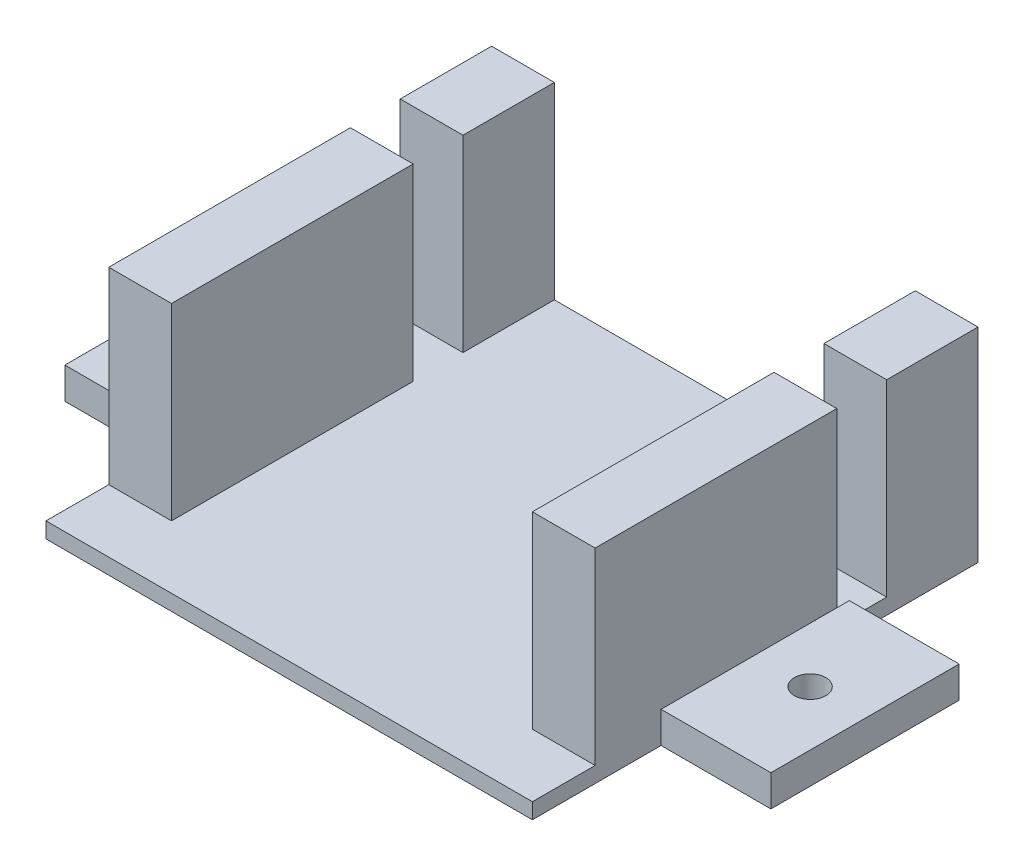
from build123d import *

# Parameters (mm, degrees)
SKETCH1_W           = 31
SKETCH1_H           = 28.4
BOSS_EXTRUDE1_DEPTH = 1
SKETCH3_W           = 4
SKETCH3_H           = 19.4
SKETCH3_H_2         = 5.825
SKETCH3_H_3         = 5.82
BOSS_EXTRUDE2_DEPTH = 12
SKETCH4_W           = 31
SKETCH4_H           = 4
CUT_EXTRUDE1_DEPTH  = 12
SKETCH7_W           = 7
SKETCH7_H           = 12
BOSS_EXTRUDE3_DEPTH = 2
SKETCH8_R           = 1
CUT_EXTRUDE4_DEPTH  = 29.790449805


with BuildPart() as part:
    # Sketch1 → Boss-Extrude1 (new body)
    with BuildSketch(Plane(origin=(0, 0, 0), x_dir=(1, 0, 0), z_dir=(0, 1, 0))):
        Rectangle(SKETCH1_W, SKETCH1_H)
    extrude(amount=BOSS_EXTRUDE1_DEPTH)

    # Sketch3 → Boss-Extrude2 (add)
    with BuildSketch(Plane(origin=(0, 1, 0), x_dir=(1, 0, 0), z_dir=(0, 1, 0))):
        with Locations((-13.5, -4.5)):
            Rectangle(SKETCH3_W, SKETCH3_H)
        with Locations((13.5, -4.5)):
            Rectangle(SKETCH3_W, SKETCH3_H)
        with Locations((-13.5, 11.2875)):
            Rectangle(SKETCH3_W, SKETCH3_H_2)
        with Locations((13.5, 11.29)):
            Rectangle(SKETCH3_W, SKETCH3_H_3)
    extrude(amount=BOSS_EXTRUDE2_DEPTH)

    # Sketch4 → Cut-Extrude1 (cut)
    with BuildSketch(Plane(origin=(0, 13, 0), x_dir=(1, 0, 0), z_dir=(0, 1, 0))):
        with Locations((0, -12.2)):
            Rectangle(SKETCH4_W, SKETCH4_H)
    extrude(amount=-CUT_EXTRUDE1_DEPTH, mode=Mode.SUBTRACT)

    # Sketch7 → Boss-Extrude3 (add)
    with BuildSketch(Plane(origin=(0, 0, 0), x_dir=(1, 0, 0), z_dir=(0, 1, 0))):
        with Locations((19, 0)):
            Rectangle(SKETCH7_W, SKETCH7_H)
        with Locations((-19, 0)):
            Rectangle(SKETCH7_W, SKETCH7_H)
    extrude(amount=BOSS_EXTRUDE3_DEPTH)

    # Sketch8 → Cut-Extrude4 (cut, through all)
    with BuildSketch(Plane(origin=(0, 2, 0), x_dir=(1, 0, 0), z_dir=(0, 1, 0))):
        with Locations(Location((-19, 0, 0), (0, 0, 270))):
            Circle(SKETCH8_R)
        with Locations(Location((19, 0, 0), (0, 0, 90))):
            Circle(SKETCH8_R)
    extrude(amount=-CUT_EXTRUDE4_DEPTH, mode=Mode.SUBTRACT)


solid = part.part
